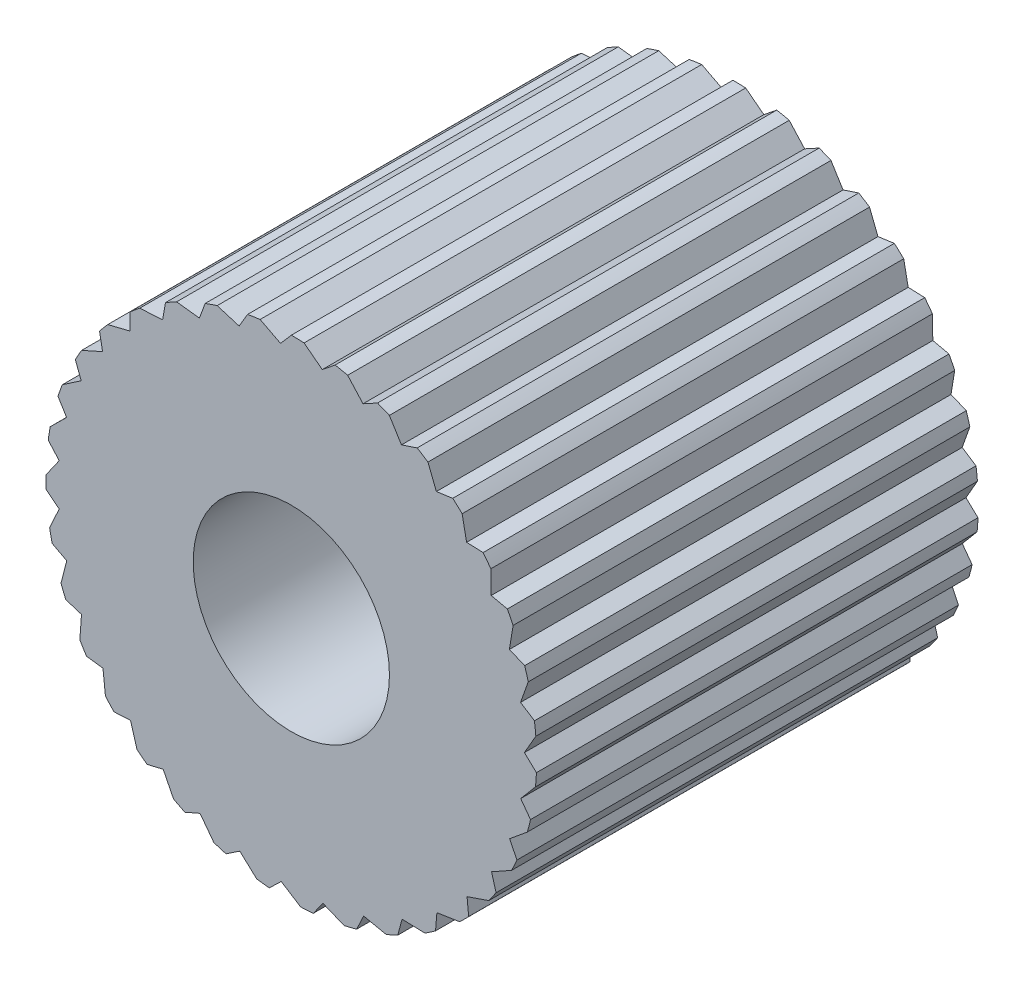
from build123d import *

# Parameters (mm, degrees)
SKETCH_1_R          = 10
EXTRUDE_1_DEPTH     = 18
CUT_EXTRUDE_1_DEPTH = 18
SKETCH_3_R          = 4
CUT_EXTRUDE_2_DEPTH = 18


with BuildPart() as part:
    # 스케치1 → 보스-돌출1 (new body)
    with BuildSketch(Plane.XY):
        Circle(SKETCH_1_R)
    extrude(amount=EXTRUDE_1_DEPTH)

    # 스케치2 → 컷-돌출1 (cut)
    with BuildSketch(Plane.XY.offset(18)):
        with BuildLine():
            Line((-1.271266061, 9.918864986), (-0.440085126, 9.489416934))
            Line((-0.440085126, 9.489416934), (0, 10))
            ThreePointArc((0, 10), (-0.652192749, 10.218898871), (-1.271266061, 9.918864986))
        make_face()
        with BuildLine():
            Line((0.52024544, 9.986458065), (1.261388044, 9.415498333))
            Line((1.261388044, 9.415498333), (1.785568948, 9.839295886))
            ThreePointArc((1.785568948, 9.839295886), (1.182943108, 10.171130474), (0.52024544, 9.986458065))
        make_face()
        with BuildLine():
            Line((2.295035824, 9.733078165), (2.922319165, 9.038957869))
            Line((2.922319165, 9.038957869), (3.513748241, 9.362348706))
            ThreePointArc((3.513748241, 9.362348706), (2.980058199, 9.796453575), (2.295035824, 9.733078165))
        make_face()
        with BuildLine():
            Line((3.996061868, 9.166869125), (4.489324543, 8.371897862))
            Line((4.489324543, 8.371897862), (5.128992774, 8.584487936))
            ThreePointArc((5.128992774, 8.584487936), (4.681391768, 9.106910598), (3.996061868, 9.166869125))
        make_face()
        with BuildLine():
            Line((5.568651195, 8.306029368), (5.912039336, 7.435758169))
            Line((5.912039336, 7.435758169), (6.579387259, 7.53071466))
            ThreePointArc((6.579387259, 7.53071466), (6.232261554, 8.12466402), (5.568651195, 8.306029368))
        make_face()
        with BuildLine():
            Line((6.962259492, 7.178226993), (7.144736321, 6.26062709))
            Line((7.144736321, 6.26062709), (7.818314825, 6.234898019))
            ThreePointArc((7.818314825, 6.234898019), (7.582821326, 6.881284056), (6.962259492, 7.178226993))
        make_face()
        with BuildLine():
            Line((8.13209504, 5.819710497), (8.147795602, 4.884274306))
            Line((8.147795602, 4.884274306), (8.805955319, 4.738686625))
            ThreePointArc((8.805955319, 4.738686625), (8.689662981, 5.416733961), (8.13209504, 5.819710497))
        make_face()
        with BuildLine():
            Line((9.040558362, 4.274143716), (8.888978028, 3.350936926))
            Line((8.888978028, 3.350936926), (9.510565163, 3.090169944))
            ThreePointArc((9.510565163, 3.090169944), (9.517211718, 3.778085579), (9.040558362, 4.274143716))
        make_face()
        with BuildLine():
            Line((9.658450699, 2.59120244), (9.344461386, 1.709897677))
            Line((9.344461386, 1.709897677), (9.909497618, 1.342332658))
            ThreePointArc((9.909497618, 1.342332658), (10.038869439, 2.018006418), (9.658450699, 2.59120244))
        make_face()
        with BuildLine():
            Line((9.965912485, 0.824977785), (9.499606067, 0.013900909))
            Line((9.499606067, 0.013900909), (9.989930665, -0.448648304))
            ThreePointArc((9.989930665, -0.448648304), (10.237869637, 0.19306687), (9.965912485, 0.824977785))
        make_face()
        with BuildLine():
            Line((9.953061643, -0.967762334), (9.349425592, -1.682542646))
            Line((9.349425592, -1.682542646), (9.749279122, -2.22520934))
            ThreePointArc((9.749279122, -2.22520934), (10.107816281, -1.638078006), (9.953061643, -0.967762334))
        make_face()
        with BuildLine():
            Line((9.62031121, -2.729397776), (8.898746887, -3.324907895))
            Line((8.898746887, -3.324907895), (9.195277726, -3.930250317))
            ThreePointArc((9.195277726, -3.930250317), (9.652889393, -3.416573707), (9.62031121, -2.729397776))
        make_face()
        with BuildLine():
            Line((8.97835606, -4.403308127), (8.162055134, -4.860407869))
            Line((8.162055134, -4.860407869), (8.345732537, -5.508969815))
            ThreePointArc((8.345732537, -5.508969815), (8.887710697, -5.085257917), (8.97835606, -4.403308127))
        make_face()
        with BuildLine():
            Line((8.047829158, -5.935692533), (7.163028213, -6.239690335))
            Line((7.163028213, -6.239690335), (7.227948638, -6.91062649))
            ThreePointArc((7.227948638, -6.91062649), (7.836873667, -6.590497754), (8.047829158, -5.935692533))
        make_face()
        with BuildLine():
            Line((6.858638405, -7.277298896), (5.933775673, -7.418424019))
            Line((5.933775673, -7.418424019), (5.877852523, -8.090169944))
            ThreePointArc((5.877852523, -8.090169944), (6.534153069, -7.883913571), (6.858638405, -7.277298896))
        make_face()
        with BuildLine():
            Line((5.449005371, -8.385006885), (4.513806699, -8.358723452))
            Line((4.513806699, -8.358723452), (4.338837391, -9.009688679))
            ThreePointArc((4.338837391, -9.009688679), (5.021419415, -8.923933919), (5.449005371, -8.385006885))
        make_face()
        with BuildLine():
            Line((3.864236821, -9.223213854), (2.948760264, -9.030366635))
            Line((2.948760264, -9.030366635), (2.660368456, -9.639628607))
            ThreePointArc((2.660368456, -9.639628607), (3.347293209, -9.677131687), (3.864236821, -9.223213854))
        make_face()
        with BuildLine():
            Line((2.15526852, -9.76497914), (1.288938249, -9.411766404))
            Line((1.288938249, -9.411766404), (0.896393089, -9.95974294))
            ThreePointArc((0.896393089, -9.95974294), (1.565582245, -10.119298481), (2.15526852, -9.76497914))
        make_face()
        with BuildLine():
            Line((0.377028115, -9.992889962), (-0.412311303, -9.490664258))
            Line((-0.412311303, -9.490664258), (-0.896393089, -9.95974294))
            ThreePointArc((-0.896393089, -9.95974294), (-0.26644782, -10.236222696), (0.377028115, -9.992889962))
        make_face()
        with BuildLine():
            Line((-1.413330284, -9.899621079), (-2.10030883, -9.264524353))
            Line((-2.10030883, -9.264524353), (-2.660368456, -9.639628607))
            ThreePointArc((-2.660368456, -9.639628607), (-2.089914033, -10.024146291), (-1.413330284, -9.899621079))
        make_face()
        with BuildLine():
            Line((-3.158263084, -9.488170229), (-3.720800703, -8.740615012))
            Line((-3.720800703, -8.740615012), (-4.338837391, -9.009688679))
            ThreePointArc((-4.338837391, -9.009688679), (-3.846208689, -9.489885576), (-3.158263084, -9.488170229))
        make_face()
        with BuildLine():
            Line((-4.801686711, -8.77176178), (-5.221702981, -7.935775113))
            Line((-5.221702981, -7.935775113), (-5.877852523, -8.090169944))
            ThreePointArc((-5.877852523, -8.090169944), (-5.478883034, -8.65061213), (-4.801686711, -8.77176178))
        make_face()
        with BuildLine():
            Line((-6.290780175, -7.773421691), (-6.554775427, -6.875872872))
            Line((-6.554775427, -6.875872872), (-7.227948638, -6.91062649))
            ThreePointArc((-7.227948638, -6.91062649), (-6.935461569, -7.533300893), (-6.290780175, -7.773421691))
        make_face()
        with BuildLine():
            Line((-7.577682789, -6.525237433), (-7.677171999, -5.59497442))
            Line((-7.677171999, -5.59497442), (-8.345732537, -5.508969815))
            ThreePointArc((-8.345732537, -5.508969815), (-8.169128664, -6.173863166), (-7.577682789, -6.525237433))
        make_face()
        with BuildLine():
            Line((-8.621032443, -5.067326674), (-8.552817945, -4.134248887))
            Line((-8.552817945, -4.134248887), (-9.195277726, -3.930250317))
            ThreePointArc((-9.195277726, -3.930250317), (-9.140233241, -4.615992398), (-8.621032443, -5.067326674))
        make_face()
        with BuildLine():
            Line((-9.387295021, -3.446547867), (-9.153569286, -2.540645192))
            Line((-9.153569286, -2.540645192), (-9.749279122, -2.22520934))
            ThreePointArc((-9.749279122, -2.22520934), (-9.817563202, -2.909759836), (-9.387295021, -3.446547867))
        make_face()
        with BuildLine():
            Line((-9.851842212, -1.714994175), (-9.460117378, -0.865383071))
            Line((-9.460117378, -0.865383071), (-9.989930665, -0.448648304))
            ThreePointArc((-9.989930665, -0.448648304), (-10.179348603, -1.110005198), (-9.851842212, -1.714994175))
        make_face()
        with BuildLine():
            Line((-9.99974309, 0.07168084), (-9.462609514, 0.837693175))
            Line((-9.462609514, 0.837693175), (-9.909497618, 1.342332658))
            ThreePointArc((-9.909497618, 1.342332658), (-10.213961365, 0.725425919), (-9.99974309, 0.07168084))
        make_face()
        with BuildLine():
            Line((-9.826243996, 1.856051975), (-9.160965594, 2.513845272))
            Line((-9.160965594, 2.513845272), (-9.510565163, 3.090169944))
            ThreePointArc((-9.510565163, 3.090169944), (-9.920289004, 2.537541251), (-9.826243996, 1.856051975))
        make_face()
        with BuildLine():
            Line((-9.336921335, 3.580768071), (-8.564880702, 4.109200314))
            Line((-8.564880702, 4.109200314), (-8.805955319, 4.738686625))
            ThreePointArc((-8.805955319, 4.738686625), (-9.307770392, 4.268097919), (-9.336921335, 3.580768071))
        make_face()
        with BuildLine():
            Line((-8.54750234, 5.190395336), (-7.693513497, 5.572482277))
            Line((-7.693513497, 5.572482277), (-7.818314825, 6.234898019))
            ThreePointArc((-7.818314825, 6.234898019), (-8.396092381, 5.861474409), (-8.54750234, 5.190395336))
        make_face()
        with BuildLine():
            Line((-7.483359587, 6.633199024), (-6.574870438, 6.856660075))
            Line((-6.574870438, 6.856660075), (-6.579387259, 7.53071466))
            ThreePointArc((-6.579387259, 7.53071466), (-7.214557053, 7.266458288), (-7.483359587, 6.633199024))
        make_face()
        with BuildLine():
            Line((-6.1786955, 7.862806237), (-5.244905634, 7.920459176))
            Line((-5.244905634, 7.920459176), (-5.128992774, 8.584487936))
            ThreePointArc((-5.128992774, 8.584487936), (-5.801139925, 8.437892218), (-6.1786955, 7.862806237))
        make_face()
        with BuildLine():
            Line((-4.675443055, 8.839696388), (-3.746365247, 8.729688202))
            Line((-3.746365247, 8.729688202), (-3.513748241, 9.362348706))
            ThreePointArc((-3.513748241, 9.362348706), (-4.201269387, 9.33812535), (-4.675443055, 8.839696388))
        make_face()
        with BuildLine():
            Line((-3.021918024, 9.532471424), (-2.127413598, 9.258337866))
            Line((-2.127413598, 9.258337866), (-1.785568948, 9.839295886))
            ThreePointArc((-1.785568948, 9.839295886), (-2.466366594, 9.93822345), (-3.021918024, 9.532471424))
        make_face()
    extrude(amount=-CUT_EXTRUDE_1_DEPTH, mode=Mode.SUBTRACT)

    # 스케치3 → 컷-돌출2 (cut)
    with BuildSketch(Plane.XY.offset(18)):
        Circle(SKETCH_3_R)
    extrude(amount=-CUT_EXTRUDE_2_DEPTH, mode=Mode.SUBTRACT)


solid = part.part
